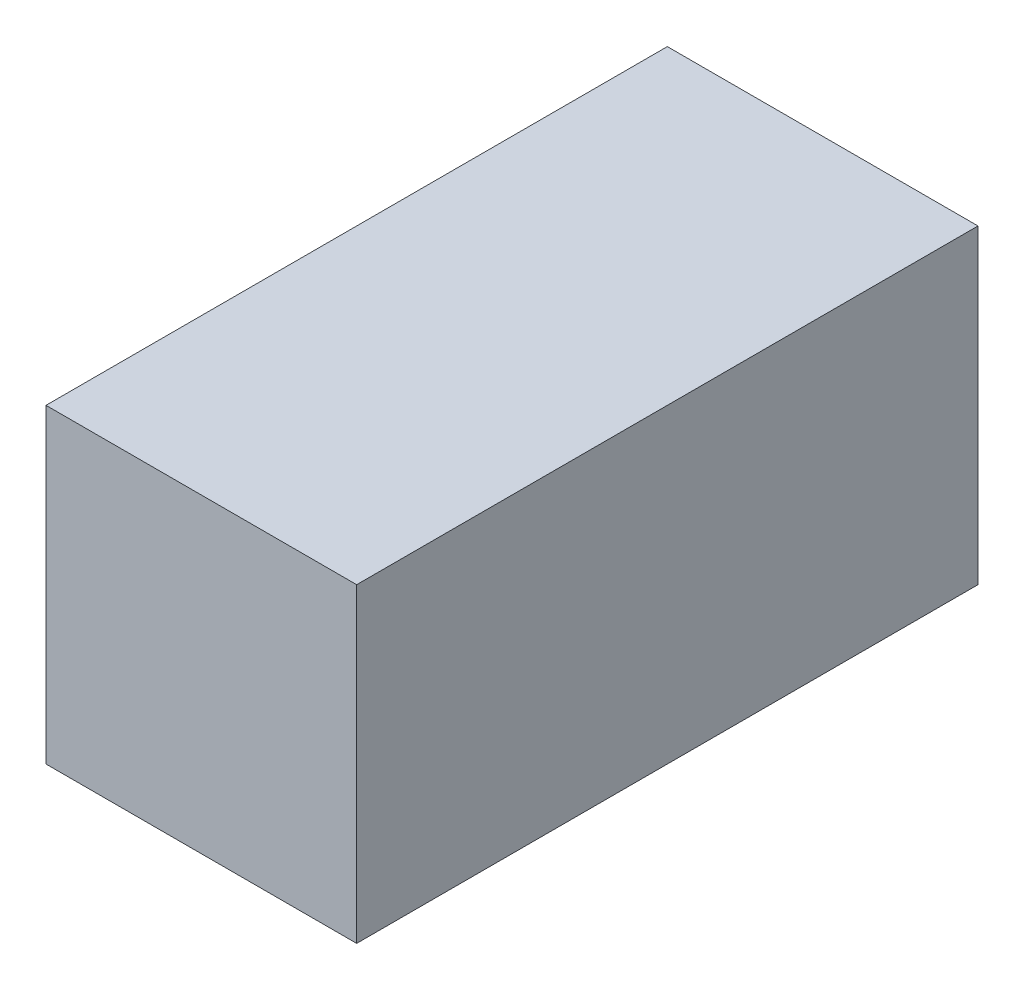
from build123d import *

# Parameters (mm, degrees)
SKETCH1_W           = 20
SKETCH1_H           = 10
BOSS_EXTRUDE1_DEPTH = 10


with BuildPart() as part:
    # Sketch1 → Boss-Extrude1 (new body)
    with BuildSketch(Plane(origin=(0, 0, 0), x_dir=(0, 0, -1), z_dir=(1, 0, 0))):
        with Locations((10, 5)):
            Rectangle(SKETCH1_W, SKETCH1_H)
    extrude(amount=BOSS_EXTRUDE1_DEPTH)


solid = part.part
